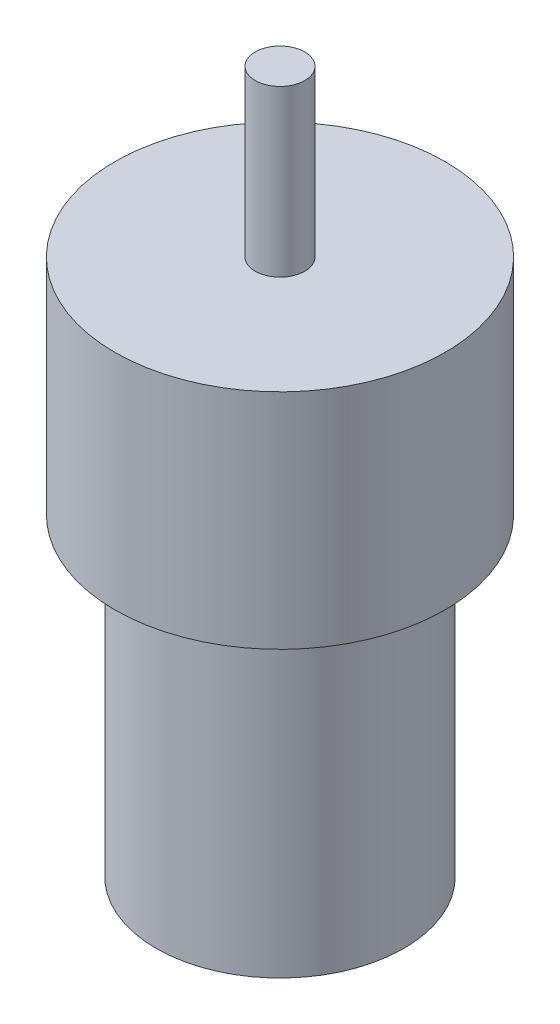
from build123d import *


with BuildPart() as part:
    # Sketch1 → Revolve1 (revolve)
    with BuildSketch(Plane.XY, mode=Mode.PRIVATE) as revolve1_sk:
        Polygon((0, 85), (0, 0), (15, 0), (15, 38), (20, 38), (20, 65), (3, 65), (3, 85), align=None)
    revolve(revolve1_sk.sketch.rotate(Axis((0, 85, 0), (0, -1, 0)), 90), axis=Axis((0, 85, 0), (0, -1, 0)))


solid = part.part
